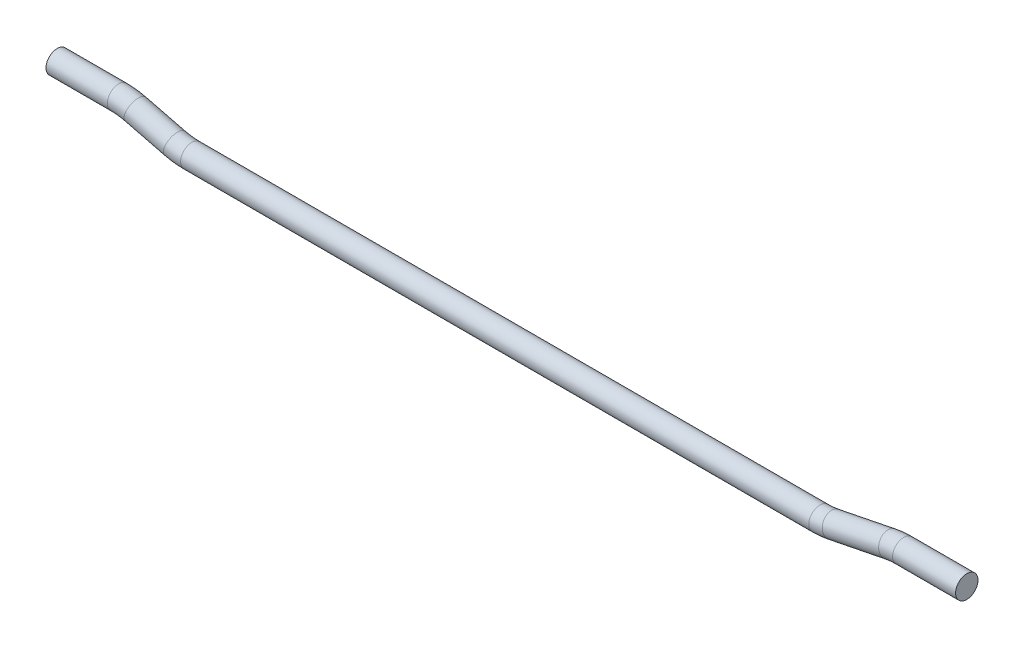
from build123d import *

# Parameters (mm, degrees)
SKETCH1_R = 0.8


with BuildPart() as part:
    # Sweep1: sweep along a path in Sketch2
    with BuildLine(Plane.XY) as sweep1_path:
        Line((0, 0), (4.384990787, 0))
        ThreePointArc((4.384990787, 0), (4.995399757, -0.037399786), (5.596677062, -0.149039645))
        Line((5.596677062, -0.149039645), (8.406801769, -0.850960355))
        ThreePointArc((8.406801769, -0.850960355), (9.008079074, -0.962600214), (9.618488045, -1))
        Line((9.618488045, -1), (54.504902432, -1))
        ThreePointArc((54.504902432, -1), (54.997590522, -0.975666633), (55.485483108, -0.902903378))
        Line((55.485483108, -0.902903378), (59.514516892, -0.097096622))
        ThreePointArc((59.514516892, -0.097096622), (60.002409478, -0.024333367), (60.495097568, 0))
        Line((60.495097568, 0), (65, 0))
    # Sketch1 → Sweep1 (sweep)
    with BuildSketch(Plane(origin=(0, 0, 0), x_dir=(0, 0, -1), z_dir=(1, 0, 0))):
        Circle(SKETCH1_R)
    sweep(path=sweep1_path.line)


solid = part.part
